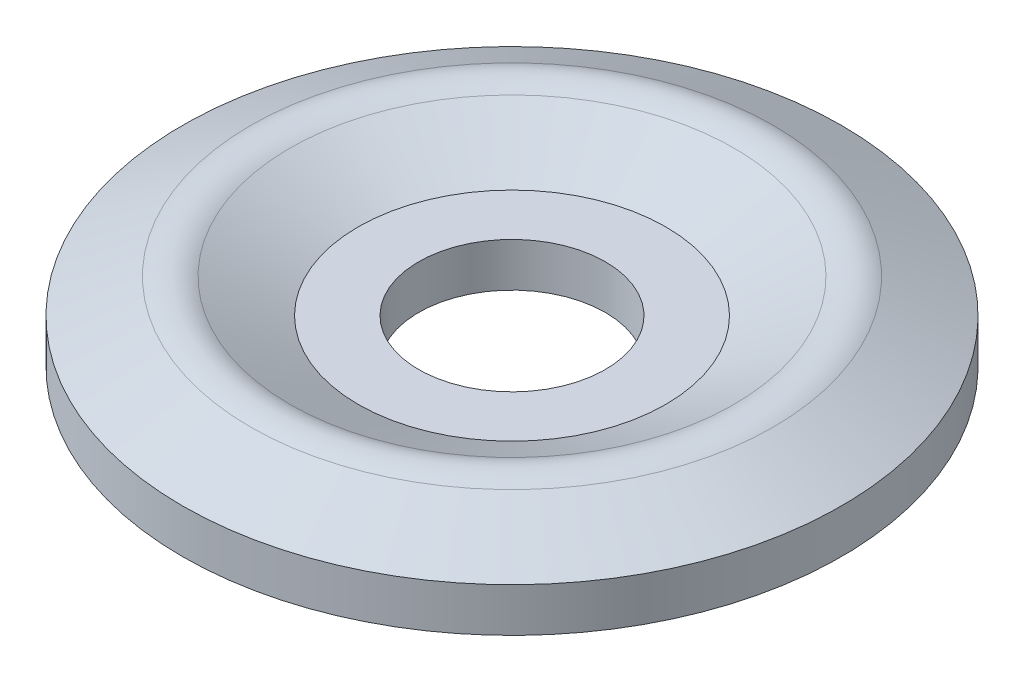
from build123d import *

# Parameters (mm, degrees)
FILLET1_R = 2


with BuildPart() as part:
    # Sketch1 → Revolve1 (revolve)
    with BuildSketch(Plane(origin=(0, 0, 0), x_dir=(0, 0, -1), z_dir=(1, 0, 0)), mode=Mode.PRIVATE) as revolve1_sk:
        Polygon((-15, 0), (-15, -2), (-11, 0), (-7, -2), (-4.25, -2), (-4.25, 0), (-7, 0), (-11, 2), align=None)
    revolve(revolve1_sk.sketch.rotate(Axis((0, -2, 0), (0, 1, 0)), 180), axis=Axis((0, -2, 0), (0, 1, 0)))

    # Fillet1
    fillet1_edges = [part.edges().sort_by_distance(p)[0] for p in [
        (0, 2, 11),
        (0, 0, 11),
    ]]
    fillet(fillet1_edges, radius=FILLET1_R)


solid = part.part
